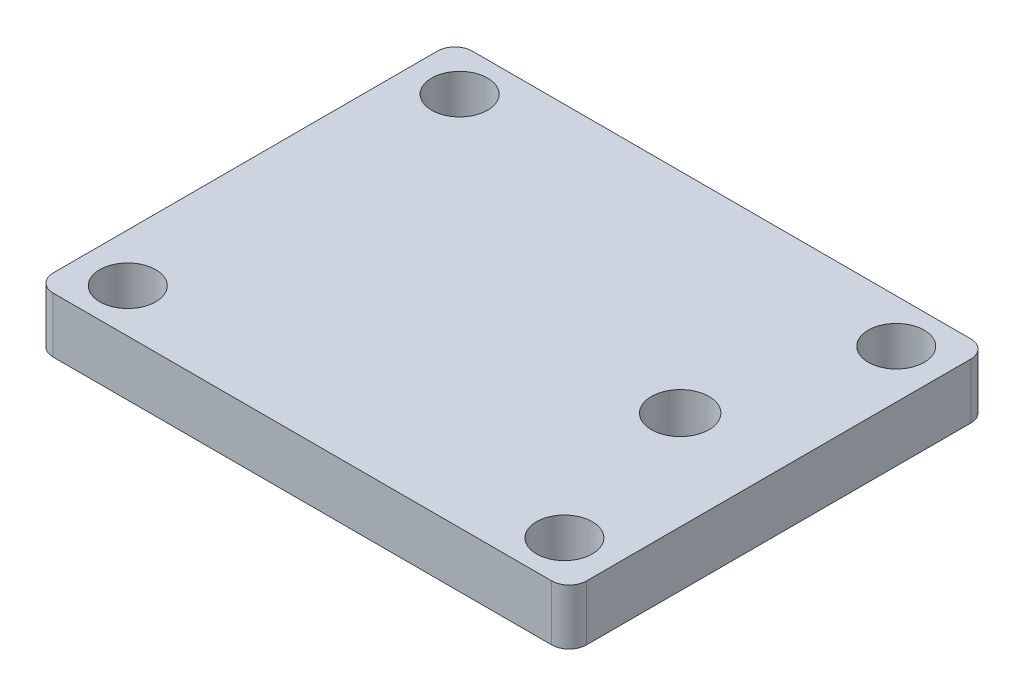
from build123d import *

# Parameters (mm, degrees)
SKETCH1_W           = 30.54
SKETCH1_H           = 24
SKETCH1_R           = 1.6
BOSS_EXTRUDE1_DEPTH = 3.175
FILLET1_R           = 1
CUT_EXTRUDE1_REACH  = 21.679
SKETCH3_R           = 1.65


with BuildPart() as part:
    # Sketch1 → Boss-Extrude1 (new body)
    with BuildSketch(Plane(origin=(0, 0, 0), x_dir=(1, 0, 0), z_dir=(0, 1, 0))):
        Rectangle(SKETCH1_W, SKETCH1_H)
        with Locations(Location((-12.5, 9.5, 0), (0, 0, 270))):
            Circle(SKETCH1_R, mode=Mode.SUBTRACT)
        with Locations(Location((-12.5, -9.5, 0), (0, 0, 270))):
            Circle(SKETCH1_R, mode=Mode.SUBTRACT)
        with Locations(Location((12.5, -9.5, 0), (0, 0, 270))):
            Circle(SKETCH1_R, mode=Mode.SUBTRACT)
        with Locations(Location((12.5, 9.5, 0), (0, 0, 270))):
            Circle(SKETCH1_R, mode=Mode.SUBTRACT)
    extrude(amount=BOSS_EXTRUDE1_DEPTH)

    # Fillet1
    fillet1_edges = [part.edges().sort_by_distance(p)[0] for p in [
        (15.27, 1.5875, 12),
        (-15.27, 1.5875, 12),
        (-15.27, 1.5875, -12),
        (15.27, 1.5875, -12),
    ]]
    fillet(fillet1_edges, radius=FILLET1_R)

    # Sketch3 → Cut-Extrude1 (cut, up to next)
    with BuildSketch(Plane(origin=(0, 3.175, 0), x_dir=(1, 0, 0), z_dir=(0, 1, 0)), mode=Mode.PRIVATE) as cut_extrude1_sk1:
        with Locations(Location((9.63, 0, 0), (0, 0, 270))):
            Circle(SKETCH3_R)
    cut_extrude1_tool1 = extrude(cut_extrude1_sk1.sketch, amount=-CUT_EXTRUDE1_REACH, mode=Mode.PRIVATE) & part.part
    add(cut_extrude1_tool1.solids().sort_by_distance((9.63, 3.175, 0))[0], mode=Mode.SUBTRACT)


solid = part.part
